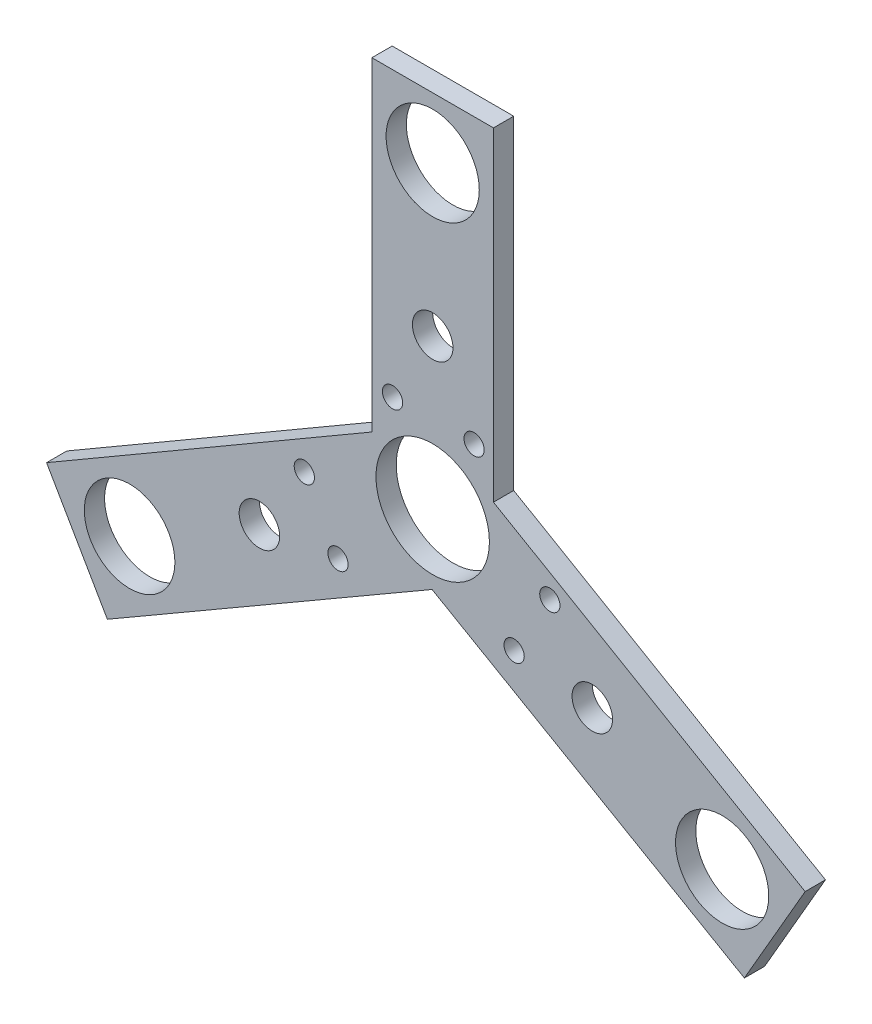
from build123d import *

# Parameters (mm, degrees)
SKETCH1_R           = 28
SKETCH1_R_2         = 23
SKETCH1_R_3         = 22.356889663
SKETCH1_R_4         = 10
BOSS_EXTRUDE5_DEPTH = 10
SKETCH3_R           = 5
CUT_EXTRUDE1_DEPTH  = 261.971545909


with BuildPart() as part:
    # Sketch1 → Boss-Extrude5 (new body)
    with BuildSketch(Plane.XY):
        Polygon((-30, 178), (30, 178), (30, 18), (183.857450853, -71.509132591), (153.857450853, -123.470656818), (-0.295071021, -34.470656818), (-160.583702803, -127.354060192), (-190.583702803, -75.392535965), (-30, 18), align=None)
        Circle(SKETCH1_R, mode=Mode.SUBTRACT)
        with Locations((0, 148)):
            Circle(SKETCH1_R_2, mode=Mode.SUBTRACT)
        with Locations((-149.602940689, -86.373298079)):
            Circle(SKETCH1_R_3, mode=Mode.SUBTRACT)
        with Locations((142.876688739, -82.489894704)):
            Circle(SKETCH1_R_2, mode=Mode.SUBTRACT)
        with Locations((0, 74)):
            Circle(SKETCH1_R_4, mode=Mode.SUBTRACT)
        with Locations((-85.517060809, -49.373298079)):
            Circle(SKETCH1_R_4, mode=Mode.SUBTRACT)
        with Locations((78.790808859, -45.489894704)):
            Circle(SKETCH1_R_4, mode=Mode.SUBTRACT)
    extrude(amount=-BOSS_EXTRUDE5_DEPTH)

    # Sketch3 → Cut-Extrude1 (cut, through all)
    with BuildSketch(Plane.XY):
        with Locations((-63.35415014, -15.760585401)):
            Circle(SKETCH3_R)
        with Locations((-46.739077881, -44.538734725)):
            Circle(SKETCH3_R)
        with Locations((40.201063697, -40.329293976)):
            Circle(SKETCH3_R)
        with Locations((57.836027276, -9.784641068)):
            Circle(SKETCH3_R)
        with Locations((-19.80604921, 38)):
            Circle(SKETCH3_R)
        with Locations((20.434338159, 38)):
            Circle(SKETCH3_R)
    extrude(amount=-CUT_EXTRUDE1_DEPTH, mode=Mode.SUBTRACT)


solid = part.part
